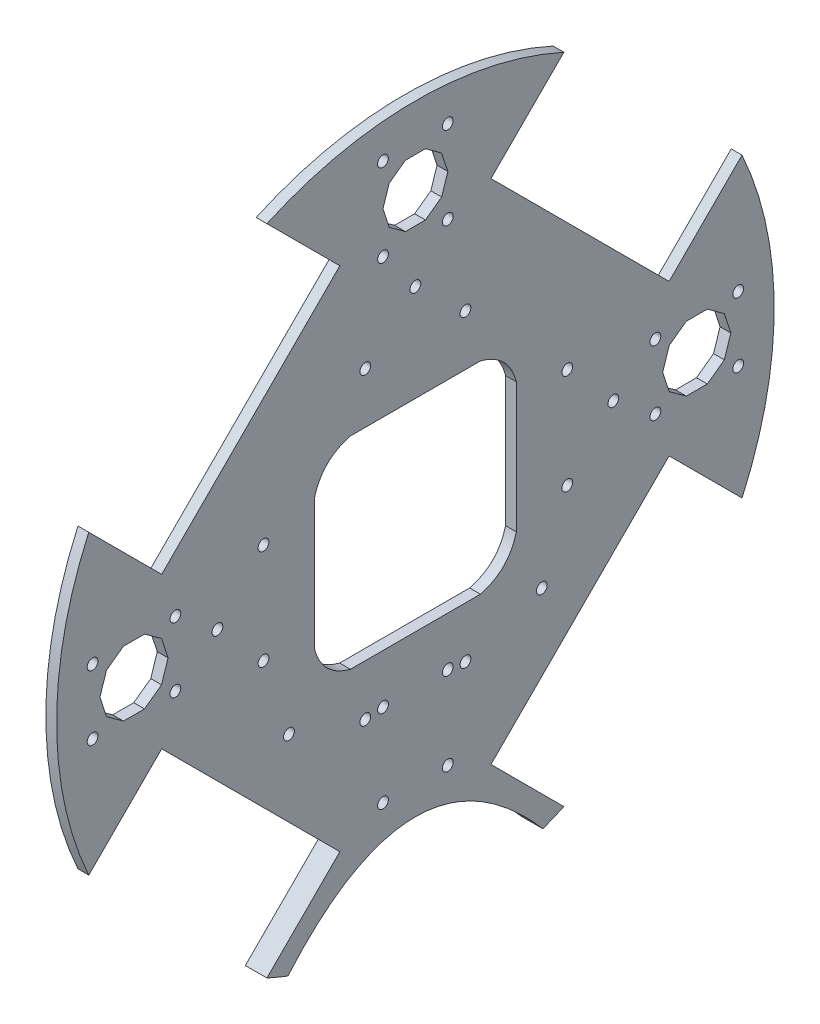
from build123d import *

# Parameters (mm, degrees)
BOSS_EXTRUDE5_DEPTH       = 3
SKETCH5_R                 = 1.5
CUT_EXTRUDE2_DEPTH        = 3
SKETCH6_R                 = 1.5
CUT_EXTRUDE3_DEPTH        = 3
BOSS_EXTRUDE7_DEPTH       = 3
SKETCH8_R                 = 1.5
CUT_EXTRUDE4_DEPTH        = 3
CUT_EXTRUDE5_DEPTH        = 3
SKETCH10_W                = 8
SKETCH10_H                = 8
BOSS_EXTRUDE9_DEPTH       = 3
SKETCH11_R                = 4.256779094
BOSS_EXTRUDE10_DEPTH      = 3
SKETCH12_R                = 5
CUT_EXTRUDE6_DEPTH        = 2
SKETCH13_R                = 1.5
CUT_EXTRUDE10_DEPTH       = 10
CUT_EXTRUDE11_DEPTH       = 10
BOSS_EXTRUDE11_DEPTH      = 3
CUT_EXTRUDE13_DEPTH       = 3
BOSS_EXTRUDE13_DEPTH      = 6
SKETCH19_R                = 1.5
CUT_EXTRUDE14_DEPTH       = 6
BOSS_EXTRUDE15_START      = -3
SKETCH20_R                = 1.5
SKETCH20_R_2              = 1.804003709
SKETCH20_R_3              = 1.577159665
SKETCH20_R_4              = 1.850988058
BOSS_EXTRUDE15_DEPTH      = 3
CUT_EXTRUDE15_DEPTH       = 3
BOSS_EXTRUDE17_DEPTH      = 3
BOSS_EXTRUDE18_DEPTH      = 3
BOSS_EXTRUDE19_DEPTH      = 3
BOSS_EXTRUDE20_DEPTH      = 3
SKETCH27_R                = 37.860858363
BOSS_EXTRUDE21_DEPTH      = 3
SKETCH28_R                = 1.5
CUT_EXTRUDE16_DEPTH       = 3
CUT_EXTRUDE19_DEPTH       = 3
CUT_EXTRUDE21_DEPTH       = 1
CUT_EXTRUDE21_DEPTH_BACK  = 2
BOSS_EXTRUDE22_DEPTH      = 2
BOSS_EXTRUDE22_DEPTH_BACK = 1
SKETCH33_R                = 5
CUT_EXTRUDE23_DEPTH       = 14
CUT_EXTRUDE23_DEPTH_BACK  = 25
SKETCH34_R                = 1.5


with BuildPart() as part:
    # Sketch1 → Boss-Extrude5 (new body)
    with BuildSketch(Plane(origin=(0, 0, 0), x_dir=(0, 0, -1), z_dir=(1, 0, 0))):
        with BuildLine():
            ThreePointArc((41.250629274, 90.748930851), (-0.00031223, 99.684416365), (-41.251197757, 90.74867244))
            Line((-41.251197757, 90.74867244), (-20.990052107, 70.48752679))
            Line((-20.990052107, 70.48752679), (-70.48752679, 20.990052107))
            Line((-70.48752679, 20.990052107), (-90.74867244, 41.251197757))
            ThreePointArc((-90.74867244, 41.251197757), (-99.684416365, 0), (-90.74867244, -41.251197757))
            Line((-90.74867244, -41.251197757), (-70.48752679, -20.990052107))
            Line((-70.48752679, -20.990052107), (-20.990052107, -70.48752679))
            Line((-20.990052107, -70.48752679), (-41.251197757, -90.74867244))
            ThreePointArc((-41.251197757, -90.74867244), (-35.419486474, -93.179626765), (-29.445489642, -95.236264132))
            add(Edge.make_bspline(
                [(-29.445489642, -95.236264132), (0, -54.132568598), (29.445489642, -95.236264132)],
                knots=[0, 0, 0, 1, 1, 1], degree=2))
            ThreePointArc((29.445489642, -95.236264132), (35.419486474, -93.179626765), (41.251197757, -90.74867244))
            Line((41.251197757, -90.74867244), (19.214516696, -68.711991379))
            Line((19.214516696, -68.711991379), (70.485246529, -20.987771846))
            Line((70.485246529, -20.987771846), (90.74867244, -41.251197757))
            ThreePointArc((90.74867244, -41.251197757), (97.424871861, -21.103961926), (99.684416365, 0))
            ThreePointArc((99.684416365, 0), (97.424871861, 21.103961926), (90.74867244, 41.251197757))
            Line((90.74867244, 41.251197757), (70.485246529, 20.987771846))
            Line((70.485246529, 20.987771846), (20.985491584, 70.48752679))
            Line((20.985491584, 70.48752679), (41.250629274, 90.748930851))
        make_face()
    extrude(amount=BOSS_EXTRUDE5_DEPTH)

    # Sketch5 → Cut-Extrude2 (cut)
    with BuildSketch(Plane(origin=(3, 0, 0), x_dir=(0, 0, -1), z_dir=(1, 0, 0))):
        Polygon((21.650635095, -37.5), (43.301270189, 0), (21.650635095, 37.5), (-21.650635095, 37.5), (-43.301270189, 0), (-21.650635095, -37.5), align=None)
        with Locations((0, -55)):
            Circle(SKETCH5_R)
        with Locations((-55, 0)):
            Circle(SKETCH5_R)
        with Locations((0, 55)):
            Circle(SKETCH5_R)
        with Locations((55, 0)):
            Circle(SKETCH5_R)
    extrude(amount=-CUT_EXTRUDE2_DEPTH, mode=Mode.SUBTRACT)

    # Sketch6 → Cut-Extrude3 (cut)
    with BuildSketch(Plane(origin=(3, 0, 0), x_dir=(0, 0, -1), z_dir=(1, 0, 0))):
        with Locations((-89.684840472, 8.999805009)):
            Circle(SKETCH6_R)
        with Locations((-66.684840472, 8.999805009)):
            Circle(SKETCH6_R)
        with Locations((-89.684840472, -8.998045705)):
            Circle(SKETCH6_R)
        with Locations((-66.684840472, -8.998045705)):
            Circle(SKETCH6_R)
        with Locations((8.990740258, 89.687847266)):
            Circle(SKETCH6_R)
        with Locations((-9.009259742, 89.687847266)):
            Circle(SKETCH6_R)
        with Locations((-9.009259742, 66.687847266)):
            Circle(SKETCH6_R)
        with Locations((8.990740258, 66.687847266)):
            Circle(SKETCH6_R)
        with Locations((66.677835848, 9.005068734)):
            Circle(SKETCH6_R)
        with Locations((89.677835848, 9.005068734)):
            Circle(SKETCH6_R)
        with Locations((89.677835848, -8.99278198)):
            Circle(SKETCH6_R)
        with Locations((66.677835848, -8.99278198)):
            Circle(SKETCH6_R)
        with Locations((9, -41.684416365)):
            Circle(SKETCH6_R)
        with Locations((-9, -41.684416365)):
            Circle(SKETCH6_R)
        with Locations((-9, -64.684416365)):
            Circle(SKETCH6_R)
        with Locations((9, -64.684416365)):
            Circle(SKETCH6_R)
    extrude(amount=-CUT_EXTRUDE3_DEPTH, mode=Mode.SUBTRACT)

    # Sketch7 → Boss-Extrude7 (add)
    with BuildSketch(Plane(origin=(3, 0, 0), x_dir=(0, 0, -1), z_dir=(1, 0, 0))):
        Polygon((21.650635095, -37.5), (43.301270189, 0), (21.650635095, 37.5), (-21.650635095, 37.5), (-43.301270189, 0), (-21.650635095, -37.5), align=None)
    extrude(amount=-BOSS_EXTRUDE7_DEPTH)

    # Sketch8 → Cut-Extrude4 (cut)
    with BuildSketch(Plane(origin=(3, 0, 0), x_dir=(0, 0, -1), z_dir=(1, 0, 0))):
        with Locations((-49.274631818, 20.988956045)):
            Circle(SKETCH8_R)
        with Locations((-20.990008043, 49.274367419)):
            Circle(SKETCH8_R)
        with Locations((20.986587651, 49.27287476)):
            Circle(SKETCH8_R)
        with Locations((49.271211426, 20.988956045)):
            Circle(SKETCH8_R)
        with Locations((49.269208027, -20.243590668)):
            Circle(SKETCH8_R)
        with Locations((19.99043091, -47.497089719)):
            Circle(SKETCH8_R)
        with Locations((-20.990008043, -49.274014891)):
            Circle(SKETCH8_R)
        with Locations((-49.274631818, -20.990096176)):
            Circle(SKETCH8_R)
    extrude(amount=-CUT_EXTRUDE4_DEPTH, mode=Mode.SUBTRACT)

    # Sketch9 → Cut-Extrude5 (cut)
    with BuildSketch(Plane(origin=(3, 0, 0), x_dir=(0, 0, -1), z_dir=(1, 0, 0))):
        with BuildLine():
            Line((32.628432334, 7.071067812), (7.071067812, 32.628432334))
            ThreePointArc((7.071067812, 32.628432334), (0, 35.557364522), (-7.071067812, 32.628432334))
            Line((-7.071067812, 32.628432334), (-32.628432334, 7.071067812))
            ThreePointArc((-32.628432334, 7.071067812), (-35.557364522, 0), (-32.628432334, -7.071067812))
            Line((-32.628432334, -7.071067812), (-7.071067812, -32.628432334))
            ThreePointArc((-7.071067812, -32.628432334), (0, -35.557364522), (7.071067812, -32.628432334))
            Line((7.071067812, -32.628432334), (32.628432334, -7.071067812))
            ThreePointArc((32.628432334, -7.071067812), (35.557364522, 0), (32.628432334, 7.071067812))
        make_face()
    extrude(amount=-CUT_EXTRUDE5_DEPTH, mode=Mode.SUBTRACT)

    # Sketch10 → Boss-Extrude9 (add)
    with BuildSketch(Plane(origin=(3, 0, 0), x_dir=(0, 0, -1), z_dir=(1, 0, 0))):
        with BuildLine():
            Line((-4, -4), (-4, 4))
            Line((-4, 4), (-37.59573452, 4))
            ThreePointArc((-37.59573452, 4), (-41.59573452, 0), (-37.59573452, -4))
            Line((-37.59573452, -4), (-4, -4))
        make_face()
        with BuildLine():
            Line((35.557364522, 4), (4, 4))
            Line((4, 4), (4, -4))
            Line((4, -4), (35.557364522, -4))
            ThreePointArc((35.557364522, -4), (39.557364522, 0), (35.557364522, 4))
        make_face()
        with BuildLine():
            Line((4, 4), (4, 35.557364522))
            ThreePointArc((4, 35.557364522), (0, 39.557364522), (-4, 35.557364522))
            Line((-4, 35.557364522), (-4, 4))
            Line((-4, 4), (4, 4))
        make_face()
        with BuildLine():
            Line((4, -35.557364522), (4, -4))
            Line((4, -4), (-4, -4))
            Line((-4, -4), (-4, -35.557364522))
            ThreePointArc((-4, -35.557364522), (0, -39.557364522), (4, -35.557364522))
        make_face()
        Rectangle(SKETCH10_W, SKETCH10_H)
    extrude(amount=-BOSS_EXTRUDE9_DEPTH)

    # Sketch11 → Boss-Extrude10 (add)
    with BuildSketch(Plane(origin=(3, 0, 0), x_dir=(0, 0, -1), z_dir=(1, 0, 0))):
        with Locations((0, -55)):
            Circle(SKETCH11_R)
    extrude(amount=-BOSS_EXTRUDE10_DEPTH)

    # Sketch12 → Cut-Extrude6 (cut)
    with BuildSketch(Plane(origin=(3, 0, 0), x_dir=(0, 0, -1), z_dir=(1, 0, 0))):
        with Locations((0, -55)):
            Circle(SKETCH12_R)
    extrude(amount=-CUT_EXTRUDE6_DEPTH, mode=Mode.SUBTRACT)

    # Sketch13 → Cut-Extrude10 (cut)
    with BuildSketch(Plane(origin=(3, 0, 0), x_dir=(0, 0, -1), z_dir=(1, 0, 0))):
        with Locations((0, -55)):
            Circle(SKETCH13_R)
    extrude(amount=-CUT_EXTRUDE10_DEPTH, mode=Mode.SUBTRACT)

    # Sketch14 → Cut-Extrude11 (cut)
    with BuildSketch(Plane(origin=(3, 0, 0), x_dir=(0, 0, -1), z_dir=(1, 0, 0))):
        Polygon((-4, 34.722515912), (4, 34.722515912), (4, 4), (34.722515912, 4), (34.722515912, -4), (4, -4), (4, -34.722515912), (-4, -34.722515912), (-4, -4), (-34.722515912, -4), (-34.722515912, 4), (-4, 4), align=None)
    extrude(amount=-CUT_EXTRUDE11_DEPTH, mode=Mode.SUBTRACT)

    # Sketch15 → Boss-Extrude11 (add)
    with BuildSketch(Plane(origin=(3, 0, 0), x_dir=(0, 0, -1), z_dir=(1, 0, 0))):
        Polygon((19.214516696, -68.711991379), (70.485246529, -20.987771846), (20.990052107, -70.48752679), align=None)
    extrude(amount=-BOSS_EXTRUDE11_DEPTH)

    # Sketch16 → Cut-Extrude13 (cut)
    with BuildSketch(Plane(origin=(3, 0, 0), x_dir=(0, 0, -1), z_dir=(1, 0, 0))):
        Polygon((26.50307031, -98.178683464), (37.917217345, -96.52604559), (35.419486474, -93.179626765), (29.445489642, -95.236264132), align=None)
        with BuildLine():
            add(Edge.make_bspline(
                [(2e-09, -72.585971578), (17.709743238, -72.585971579), (35.419486474, -93.179626765)],
                knots=[0.5, 0.5, 0.5, 1, 1, 1], degree=2))
            Line((2e-09, -72.585971578), (4e-09, -74.684416365))
            add(Edge.make_bspline(
                [(4e-09, -74.684416365), (14.722744823, -74.684416368), (29.445489642, -95.236264132)],
                knots=[0.5, 0.5, 0.5, 1, 1, 1], degree=2))
            Line((29.445489642, -95.236264132), (35.419486474, -93.179626765))
        make_face()
        with BuildLine():
            Line((4e-09, -74.684416365), (2e-09, -72.585971578))
            add(Edge.make_bspline(
                [(-35.419486474, -93.179626765), (-17.709743236, -72.585971577), (2e-09, -72.585971578)],
                knots=[0, 0, 0, 0.5, 0.5, 0.5], degree=2))
            Line((-35.419486474, -93.179626765), (-29.445489642, -95.236264132))
            add(Edge.make_bspline(
                [(-29.445489642, -95.236264132), (-14.722744819, -74.684416363), (4e-09, -74.684416365)],
                knots=[0, 0, 0, 0.5, 0.5, 0.5], degree=2))
        make_face()
        Polygon((-36.104712311, -94.161879123), (-29.245787853, -96.615529135), (-29.445489642, -95.236264132), (-35.419486474, -93.179626765), align=None)
    extrude(amount=-CUT_EXTRUDE13_DEPTH, mode=Mode.SUBTRACT)

    # Sketch17 → Boss-Extrude13 (add)
    with BuildSketch(Plane(origin=(3, 0, 0), x_dir=(0, 0, -1), z_dir=(1, 0, 0))):
        with BuildLine():
            Line((-41.251197757, -90.74867244), (-20.990052107, -70.48752679))
            Line((-20.990052107, -70.48752679), (20.990052107, -70.48752679))
            Line((20.990052107, -70.48752679), (41.251197757, -90.74867244))
            Line((41.251197757, -90.74867244), (35.419486474, -93.179626765))
            add(Edge.make_bspline(
                [(-35.419486474, -93.179626765), (0, -51.992316391), (35.419486474, -93.179626765)],
                knots=[0, 0, 0, 1, 1, 1], degree=2))
            Line((-35.419486474, -93.179626765), (-41.251197757, -90.74867244))
        make_face()
    extrude(amount=-BOSS_EXTRUDE13_DEPTH)

    # Sketch19 → Cut-Extrude14 (cut)
    with BuildSketch(Plane.ZY.offset(3)):
        with Locations((-52.804741933, -23.779124574)):
            Circle(SKETCH19_R)
        with Locations((-52.806745332, 24.524489951)):
            Circle(SKETCH19_R)
        with Locations((-23.525964816, -51.032623624)):
            Circle(SKETCH19_R)
        with Locations((24.525541949, -52.809548797)):
            Circle(SKETCH19_R)
        with Locations((52.810165724, -24.525630082)):
            Circle(SKETCH19_R)
        with Locations((52.788011048, 24.52037127)):
            Circle(SKETCH19_R)
        with Locations((24.525541949, 52.809901325)):
            Circle(SKETCH19_R)
        with Locations((-24.523614216, 52.809901325)):
            Circle(SKETCH19_R)
    extrude(amount=-CUT_EXTRUDE14_DEPTH, mode=Mode.SUBTRACT)

    # Sketch20 → Boss-Extrude15 (add)
    with BuildSketch(Plane.ZY.offset(BOSS_EXTRUDE15_START)):
        with Locations((-49.269208027, -20.243590668)):
            Circle(SKETCH20_R)
        with Locations((-19.99043091, -47.497089719)):
            Circle(SKETCH20_R)
        with Locations((-49.271211426, 20.988956045)):
            Circle(SKETCH20_R)
        with Locations((-20.986587651, 49.27287476)):
            Circle(SKETCH20_R_2)
        with Locations((20.990008043, 49.274367419)):
            Circle(SKETCH20_R_3)
        with Locations((49.274631818, 20.988956045)):
            Circle(SKETCH20_R)
        with Locations((49.274631818, -20.990096176)):
            Circle(SKETCH20_R)
        with Locations((20.990008043, -49.274014891)):
            Circle(SKETCH20_R_4)
    extrude(amount=BOSS_EXTRUDE15_DEPTH)

    # Sketch21 → Cut-Extrude15 (cut)
    with BuildSketch(Plane.ZY):
        Polygon((87.64800049, 0.000879652), (85.840697747, 5.563185551), (81.109117738, 9.000879652), (75.260563206, 9.000879652), (70.528983197, 5.563185551), (68.721680454, 0.000879652), (70.528983197, -5.561426247), (75.260563206, -8.999120348), (81.109117738, -8.999120348), (85.840697747, -5.561426247), align=None)
        Polygon((-68.714675829, 0.006143377), (-70.521978572, 5.568449276), (-75.253558581, 9.006143377), (-81.102113114, 9.006143377), (-85.833693123, 5.568449276), (-87.640995866, 0.006143377), (-85.833693123, -5.556162522), (-81.102113114, -8.993856623), (-75.253558581, -8.993856623), (-70.521978572, -5.556162522), align=None)
        Polygon((9.009259742, 78.187847266), (7.288644238, 83.483357276), (2.784014367, 86.756162451), (-2.784014367, 86.756162451), (-7.288644238, 83.483357276), (-9.009259742, 78.187847266), (-7.288644238, 72.892337255), (-2.784014367, 69.619532081), (2.784014367, 69.619532081), (7.288644238, 72.892337255), align=None)
    extrude(amount=-CUT_EXTRUDE15_DEPTH, mode=Mode.SUBTRACT)

    # Sketch23 → Boss-Extrude17 (add)
    with BuildSketch(Plane.ZY):
        with BuildLine():
            Line((23.185110357, -47.931259664), (48.451410638, -22.331234981))
            ThreePointArc((48.451410638, -22.331234981), (55.018478109, -22.288149685), (55.061563405, -28.855217156))
            Line((55.061563405, -28.855217156), (29.795263123, -54.455241839))
            ThreePointArc((29.795263123, -54.455241839), (23.228195653, -54.498327135), (23.185110357, -47.931259664))
        make_face()
    extrude(amount=-BOSS_EXTRUDE17_DEPTH)

    # Sketch24 → Boss-Extrude18 (add)
    with BuildSketch(Plane.ZY):
        with BuildLine():
            Line((-49.932957311, -22.25705248), (-21.687459374, -49.097903422))
            ThreePointArc((-21.687459374, -49.097903422), (-21.537171902, -54.991760138), (-27.431028618, -55.14204761))
            Line((-27.431028618, -55.14204761), (-55.676526555, -28.301196668))
            ThreePointArc((-55.676526555, -28.301196668), (-55.826814027, -22.407339952), (-49.932957311, -22.25705248))
        make_face()
    extrude(amount=-BOSS_EXTRUDE18_DEPTH)

    # Sketch25 → Boss-Extrude19 (add)
    with BuildSketch(Plane.ZY):
        with BuildLine():
            Line((-53.924823816, 27.2021117), (-26.093024774, 54.415004738))
            ThreePointArc((-26.093024774, 54.415004738), (-20.797324541, 54.355461474), (-20.856867805, 49.05976124))
            Line((-20.856867805, 49.05976124), (-48.688666847, 21.846868201))
            ThreePointArc((-48.688666847, 21.846868201), (-53.984367081, 21.906411466), (-53.924823816, 27.2021117))
        make_face()
    extrude(amount=-BOSS_EXTRUDE19_DEPTH)

    # Sketch26 → Boss-Extrude20 (add)
    with BuildSketch(Plane.ZY):
        with BuildLine():
            Line((27.568598887, 54.349884375), (54.331067987, 27.56035432))
            ThreePointArc((54.331067987, 27.56035432), (54.327994098, 21.477314332), (48.24495411, 21.48038822))
            Line((48.24495411, 21.48038822), (21.482485011, 48.269918275))
            ThreePointArc((21.482485011, 48.269918275), (21.485558899, 54.352958263), (27.568598887, 54.349884375))
        make_face()
    extrude(amount=-BOSS_EXTRUDE20_DEPTH)

    # Sketch27 → Boss-Extrude21 (add)
    with BuildSketch(Plane.ZY):
        Circle(SKETCH27_R)
    extrude(amount=-BOSS_EXTRUDE21_DEPTH)

    # Sketch28 → Cut-Extrude16 (cut)
    with BuildSketch(Plane.ZY):
        with Locations((-42.200975281, 13.916704034)):
            Circle(SKETCH28_R)
        with Locations((-42.20064956, -13.918007048)):
            Circle(SKETCH28_R)
        with Locations((-13.914423772, -42.206839149)):
            Circle(SKETCH28_R)
        with Locations((42.204232791, -13.918007048)):
            Circle(SKETCH28_R)
        with Locations((42.204232791, 13.918007048)):
            Circle(SKETCH28_R)
        with Locations((13.918984296, 42.203255543)):
            Circle(SKETCH28_R)
        with Locations((-13.914423772, 42.203255543)):
            Circle(SKETCH28_R)
        with Locations((13.918984296, -42.203255543)):
            Circle(SKETCH28_R)
    extrude(amount=-CUT_EXTRUDE16_DEPTH, mode=Mode.SUBTRACT)

    # Sketch29 → Cut-Extrude19 (cut)
    with BuildSketch(Plane.ZY):
        with BuildLine():
            Line((-18.057536666, -28.062423099), (18.061608543, -28.062423099))
            add(Edge.make_bspline(
                [(18.061608543, -28.062423099), (25.990540731, -25.991355287), (28.061608543, -18.062423099)],
                knots=[0, 0, 0, 1, 1, 1], degree=2))
            Line((28.061608543, -18.062423099), (28.061608543, 18.060631296))
            add(Edge.make_bspline(
                [(28.061608543, 18.060631296), (25.990540731, 25.989563484), (18.061608543, 28.060631296)],
                knots=[0.5, 0.5, 0.5, 1.5, 1.5, 1.5], degree=2))
            Line((18.061608543, 28.060631296), (-18.057536666, 28.060631296))
            add(Edge.make_bspline(
                [(-18.057536666, 28.060631296), (-25.986468854, 25.989563484), (-28.057536666, 18.060631296)],
                knots=[0.5, 0.5, 0.5, 1.5, 1.5, 1.5], degree=2))
            Line((-28.057536666, 18.060631296), (-28.057536666, -18.062423099))
            add(Edge.make_bspline(
                [(-28.057536666, -18.062423099), (-25.986468854, -25.991355287), (-18.057536666, -28.062423099)],
                knots=[0, 0, 0, 1, 1, 1], degree=2))
        make_face()
    extrude(amount=-CUT_EXTRUDE19_DEPTH, mode=Mode.SUBTRACT)

    # Sketch32 → Cut-Extrude21 (cut, two sides: drawn at the far end of the back side and taken through both)
    with BuildSketch(Plane.ZY.offset(-CUT_EXTRUDE21_DEPTH_BACK)):
        with BuildLine():
            Line((-71.899394939, 19.573753724), (-90.165369226, 37.84141105))
            add(Edge.make_bspline(
                [(-90.165369226, 37.84141105), (-102.244608241, 7.497310559), (-71.899394939, 19.573753724)],
                knots=[0, 0, 0, 1, 1, 1], degree=2))
        make_face()
        with BuildLine():
            add(Edge.make_bspline(
                [(-37.83584618, 90.166308511), (-7.490358665, 102.247227867), (-19.571278022, 71.901740353)],
                knots=[0, 0, 0, 1, 1, 1], degree=2))
            Line((-19.571278022, 71.901740353), (-37.83584618, 90.166308511))
        make_face()
        with BuildLine():
            Line((19.571278022, 71.901740353), (37.83584618, 90.166308511))
            add(Edge.make_bspline(
                [(37.83584618, 90.166308511), (7.490358665, 102.247227867), (19.571278022, 71.901740353)],
                knots=[0, 0, 0, 1, 1, 1], degree=2))
        make_face()
        with BuildLine():
            add(Edge.make_bspline(
                [(90.165369226, 37.84141105), (102.244608241, 7.497310559), (71.899394939, 19.573753724)],
                knots=[0, 0, 0, 1, 1, 1], degree=2))
            Line((71.899394939, 19.573753724), (90.165369226, 37.84141105))
        make_face()
        with BuildLine():
            Line((71.899394939, -19.573493135), (90.165369226, -37.837784536))
            add(Edge.make_bspline(
                [(90.165369226, -37.837784536), (102.244608241, -7.491458167), (71.899394939, -19.573493135)],
                knots=[0, 0, 0, 1, 1, 1], degree=2))
        make_face()
        with BuildLine():
            add(Edge.make_bspline(
                [(-90.165369226, -37.837784536), (-102.244608241, -7.491458167), (-71.899394939, -19.573493135)],
                knots=[0, 0, 0, 1, 1, 1], degree=2))
            Line((-71.899394939, -19.573493135), (-90.165369226, -37.837784536))
        make_face()
    extrude(amount=CUT_EXTRUDE21_DEPTH + CUT_EXTRUDE21_DEPTH_BACK, mode=Mode.SUBTRACT)

    # Sketch33 → Boss-Extrude22 (add, two sides: drawn at the far end of the back side and taken through both)
    with BuildSketch(Plane(origin=(1, 0, 0), x_dir=(0, 0, -1), z_dir=(1, 0, 0)).offset(-BOSS_EXTRUDE22_DEPTH_BACK)):
        with Locations((0, -55)):
            Circle(SKETCH33_R)
    extrude(amount=BOSS_EXTRUDE22_DEPTH + BOSS_EXTRUDE22_DEPTH_BACK)

    # Sketch34 → Cut-Extrude23 (cut, two sides: drawn at the far end of the back side and taken through both)
    with BuildSketch(Plane.ZY.offset(-CUT_EXTRUDE23_DEPTH_BACK)):
        with Locations(Location((-35.1310476, -35.1310476, 0), (0, 0, 180))):
            Circle(SKETCH34_R)
        with Locations(Location((35.132187731, -35.132187731, 0), (0, 0, 180))):
            Circle(SKETCH34_R)
    extrude(amount=CUT_EXTRUDE23_DEPTH + CUT_EXTRUDE23_DEPTH_BACK, mode=Mode.SUBTRACT)


solid = part.part
